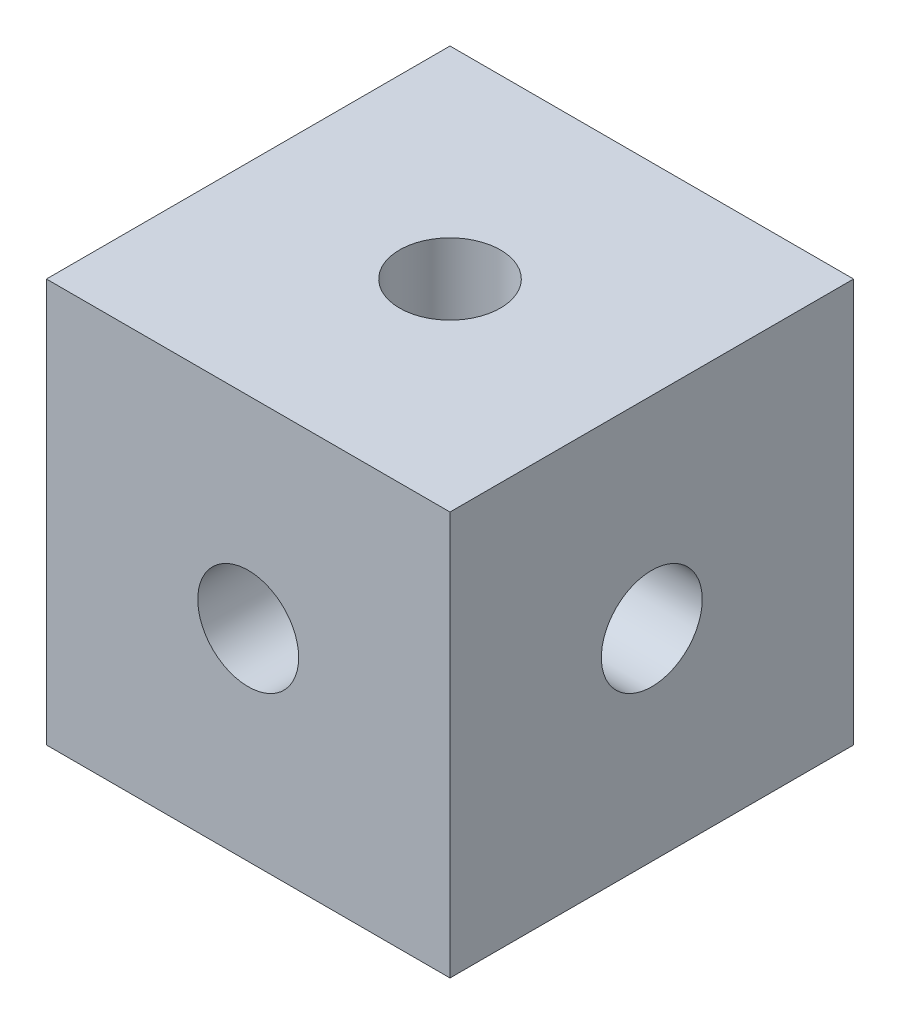
from build123d import *

# Parameters (mm, degrees)
SKETCH_1_W      = 10
SKETCH_1_H      = 10
EXTRUDE_1_DEPTH = 5
HOLE_WIZARD_1_D = 2.5
HOLE_WIZARD_2_D = 2.5
HOLE_WIZARD_3_D = 2.5


with BuildPart() as part:
    # 草图1 → 凸台-拉伸1 (new, symmetric)
    with BuildSketch(Plane(origin=(0, 0, 0), x_dir=(1, 0, 0), z_dir=(0, 1, 0))):
        Rectangle(SKETCH_1_W, SKETCH_1_H)
    extrude(amount=EXTRUDE_1_DEPTH, both=True)

    # Hole Wizard 1 (through all)
    with Locations(Plane(origin=(0, 5, 0), x_dir=(1, 0, 0), z_dir=(0, 1, 0))):
        with Locations((0, 0)):
            Hole(HOLE_WIZARD_1_D / 2)

    # Hole Wizard 2 (through all)
    with Locations(Plane(origin=(5, 0, 0), x_dir=(0, 0, -1), z_dir=(1, 0, 0))):
        with Locations((0, 0)):
            Hole(HOLE_WIZARD_2_D / 2)

    # Hole Wizard 3 (through all)
    with Locations(Plane.XY.offset(5)):
        with Locations((0, 0)):
            Hole(HOLE_WIZARD_3_D / 2)


solid = part.part
